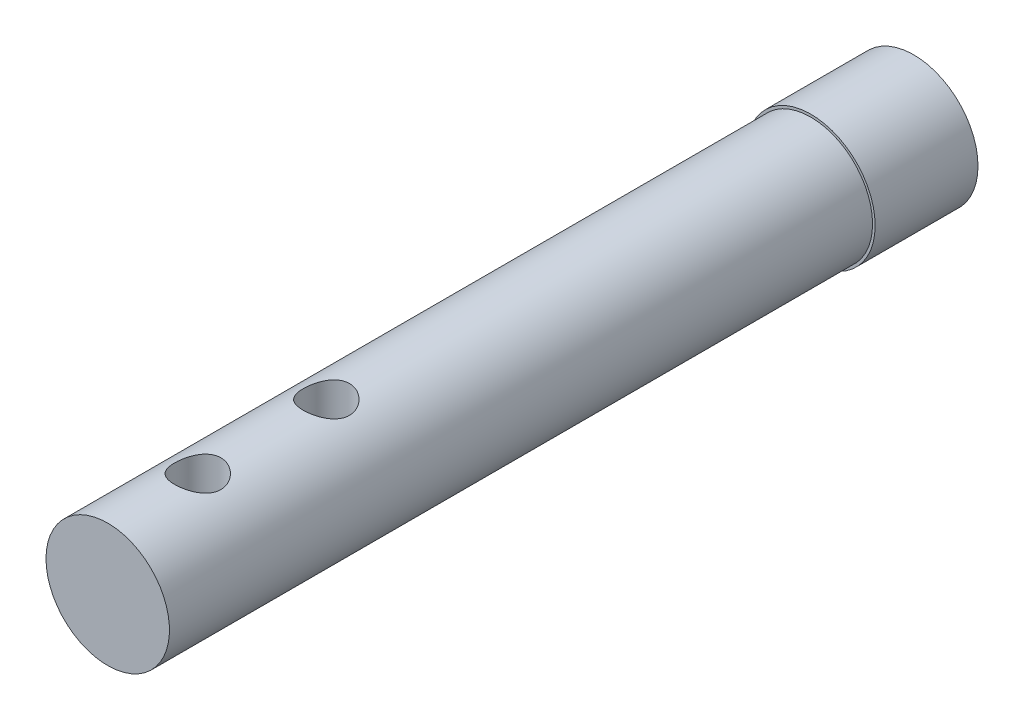
from build123d import *

# Parameters (mm, degrees)
SKETCH1_R               = 10
BOSS_EXTRUDE1_DEPTH     = 15
SKETCH2_R               = 12.5
BOSS_EXTRUDE2_DEPTH     = 20
SKETCH3_R               = 12
BOSS_EXTRUDE3_DEPTH     = 139.2
SKETCH4_R               = 4.5
CUT_EXTRUDE1_DEPTH      = 176.094660113
CUT_EXTRUDE2_DEPTH      = 176.094660212
CUT_EXTRUDE2_DEPTH_BACK = 176.094660212
SKETCH5_W               = 50.129657838
SKETCH5_H               = 19.874218845
LPATTERN1_COUNT         = 2
LPATTERN1_PITCH         = 25
CUT_EXTRUDE3_DEPTH      = 176.094660212
CUT_EXTRUDE3_DEPTH_BACK = 176.094660212
SKETCH6_W               = 35.820903931
SKETCH6_H               = 2.5


with BuildPart() as part:
    # Sketch1 → Boss-Extrude1 (new body)
    with BuildSketch(Plane.XY):
        Circle(SKETCH1_R)
    extrude(amount=BOSS_EXTRUDE1_DEPTH)

    # Sketch2 → Boss-Extrude2 (add)
    with BuildSketch(Plane.XY.offset(15)):
        Circle(SKETCH2_R)
    extrude(amount=BOSS_EXTRUDE2_DEPTH)

    # Sketch3 → Boss-Extrude3 (add)
    with BuildSketch(Plane.XY.offset(35)):
        Circle(SKETCH3_R)
    extrude(amount=BOSS_EXTRUDE3_DEPTH)

    # Sketch4 → Cut-Extrude1 (cut, symmetric)
    with BuildSketch(Plane(origin=(0, 0, 0), x_dir=(1, 0, 0), z_dir=(0, 1, 0))):
        with Locations(Location((0, -154.2, 0), (0, 0, 270))):
            Circle(SKETCH4_R)
    cut_extrude1 = extrude(amount=CUT_EXTRUDE1_DEPTH, both=True, mode=Mode.SUBTRACT)

    # Sketch5 → Cut-Extrude2 (cut, two sides: drawn at the far end of the back side and taken through both)
    with BuildSketch(Plane(origin=(0, 0, 0), x_dir=(1, 0, 0), z_dir=(0, 1, 0)).offset(-CUT_EXTRUDE2_DEPTH_BACK)):
        with Locations((-12.564828919, -5.062890578)):
            Rectangle(SKETCH5_W, SKETCH5_H)
    extrude(amount=CUT_EXTRUDE2_DEPTH + CUT_EXTRUDE2_DEPTH_BACK, mode=Mode.SUBTRACT)

    # LPattern1: Cut-Extrude1 ×2
    with Locations(*[(0, 0, -i * LPATTERN1_PITCH) for i in range(1, LPATTERN1_COUNT)]):
        add(cut_extrude1, mode=Mode.SUBTRACT)

    # Sketch6 → Cut-Extrude3 (cut, two sides: drawn at the far end of the back side and taken through both)
    with BuildSketch(Plane(origin=(0, 0, 0), x_dir=(1, 0, 0), z_dir=(0, 1, 0)).offset(-CUT_EXTRUDE3_DEPTH_BACK)):
        with Locations((-5.910451966, -172.95)):
            Rectangle(SKETCH6_W, SKETCH6_H)
    extrude(amount=CUT_EXTRUDE3_DEPTH + CUT_EXTRUDE3_DEPTH_BACK, mode=Mode.SUBTRACT)


solid = part.part
